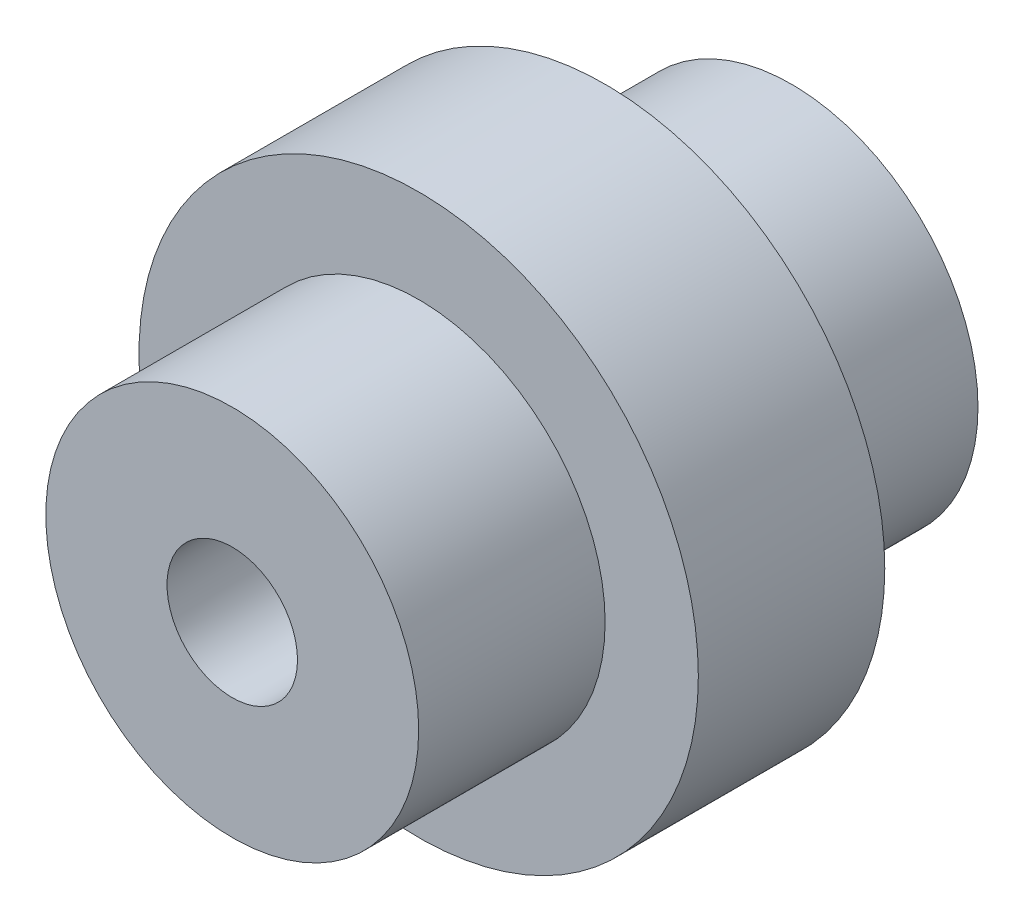
from build123d import *

# Parameters (mm, degrees)
SKETCH1_R                = 6
BOSS_EXTRUDE1_DEPTH      = 4
BOSS_EXTRUDE2_DEPTH      = 4
BOSS_EXTRUDE2_DEPTH_BACK = 8
SKETCH2_R                = 4
SKETCH8_R                = 1.4
SKETCH6_R                = 1.46


with BuildPart() as part:
    # Sketch1 → Boss-Extrude1 (new body)
    with BuildSketch(Plane.XY.offset(33)):
        Circle(SKETCH1_R)
    extrude(amount=-BOSS_EXTRUDE1_DEPTH)

    # Sketch2 → Boss-Extrude2 (add, two sides: drawn at the far end of the back side and taken through both)
    with BuildSketch(Plane.XY.offset(33).offset(-BOSS_EXTRUDE2_DEPTH_BACK)):
        Circle(SKETCH2_R)
    extrude(amount=BOSS_EXTRUDE2_DEPTH + BOSS_EXTRUDE2_DEPTH_BACK)

    # Sketch8 → Cut-Loft2 section 0
    with BuildSketch(Plane.XY.offset(37)):
        Circle(SKETCH8_R)
    # Sketch6 → Cut-Loft2 section 1
    with BuildSketch(Plane.XY.offset(25)):
        Circle(SKETCH6_R)
    loft(mode=Mode.SUBTRACT)


solid = part.part
